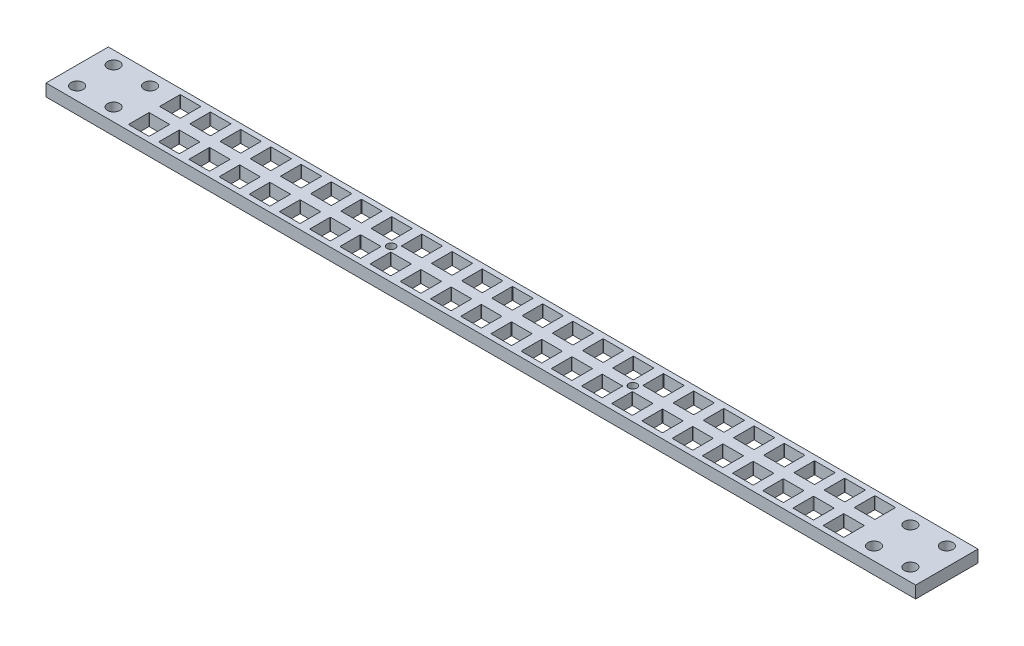
from build123d import *

# Parameters (mm, degrees)
SKETCH3_W           = 214.795858191
SKETCH3_H           = 15.4
SKETCH3_R           = 1.5
BOSS_EXTRUDE1_DEPTH = 3
SKETCH4_R           = 1
CUT_EXTRUDE1_DEPTH  = 10


with BuildPart() as part:
    # Sketch3 → Boss-Extrude1 (new body)
    with BuildSketch(Plane(origin=(0, 0, 0), x_dir=(1, 0, 0), z_dir=(0, 1, 0))):
        with Locations((30.920355434, 36.46812241)):
            Rectangle(SKETCH3_W, SKETCH3_H)
        with Locations(Location((-71.977573661, 40.96812241, 0), (0, 0, 270))):
            Circle(SKETCH3_R, mode=Mode.SUBTRACT)
        with Locations(Location((-62.977573661, 40.96812241, 0), (0, 0, 270))):
            Circle(SKETCH3_R, mode=Mode.SUBTRACT)
        with Locations(Location((-71.977573661, 31.96812241, 0), (0, 0, 270))):
            Circle(SKETCH3_R, mode=Mode.SUBTRACT)
        with Locations(Location((-62.977573661, 31.96812241, 0), (0, 0, 270))):
            Circle(SKETCH3_R, mode=Mode.SUBTRACT)
        with Locations(Location((124.81828453, 31.96812241, 0), (0, 0, 270))):
            Circle(SKETCH3_R, mode=Mode.SUBTRACT)
        with Locations(Location((133.81828453, 31.96812241, 0), (0, 0, 270))):
            Circle(SKETCH3_R, mode=Mode.SUBTRACT)
        with Locations(Location((124.81828453, 40.96812241, 0), (0, 0, 270))):
            Circle(SKETCH3_R, mode=Mode.SUBTRACT)
        with Locations(Location((133.81828453, 40.96812241, 0), (0, 0, 270))):
            Circle(SKETCH3_R, mode=Mode.SUBTRACT)
        with BuildLine():
            Line((-49.859644565, 35.16812241), (-44.959644565, 35.16812241))
            ThreePointArc((-44.959644565, 35.16812241), (-44.888933887, 35.138833089), (-44.859644565, 35.06812241))
            Line((-44.859644565, 35.06812241), (-44.859644565, 30.16812241))
            ThreePointArc((-44.859644565, 30.16812241), (-44.888933887, 30.097411732), (-44.959644565, 30.06812241))
            Line((-44.959644565, 30.06812241), (-49.859644565, 30.06812241))
            ThreePointArc((-49.859644565, 30.06812241), (-49.930355243, 30.097411732), (-49.959644565, 30.16812241))
            Line((-49.959644565, 30.16812241), (-49.959644565, 35.06812241))
            ThreePointArc((-49.959644565, 35.06812241), (-49.930355243, 35.138833089), (-49.859644565, 35.16812241))
        make_face(mode=Mode.SUBTRACT)
        with BuildLine():
            Line((-57.319644565, 35.16812241), (-52.419644565, 35.16812241))
            ThreePointArc((-52.419644565, 35.16812241), (-52.348933887, 35.138833089), (-52.319644565, 35.06812241))
            Line((-52.319644565, 35.06812241), (-52.319644565, 30.16812241))
            ThreePointArc((-52.319644565, 30.16812241), (-52.348933887, 30.097411732), (-52.419644565, 30.06812241))
            Line((-52.419644565, 30.06812241), (-57.319644565, 30.06812241))
            ThreePointArc((-57.319644565, 30.06812241), (-57.390355243, 30.097411732), (-57.419644565, 30.16812241))
            Line((-57.419644565, 30.16812241), (-57.419644565, 35.06812241))
            ThreePointArc((-57.419644565, 35.06812241), (-57.390355243, 35.138833089), (-57.319644565, 35.16812241))
        make_face(mode=Mode.SUBTRACT)
        with BuildLine():
            Line((-42.399644565, 35.16812241), (-37.499644565, 35.16812241))
            ThreePointArc((-37.499644565, 35.16812241), (-37.428933887, 35.138833089), (-37.399644565, 35.06812241))
            Line((-37.399644565, 35.06812241), (-37.399644565, 30.16812241))
            ThreePointArc((-37.399644565, 30.16812241), (-37.428933887, 30.097411732), (-37.499644565, 30.06812241))
            Line((-37.499644565, 30.06812241), (-42.399644565, 30.06812241))
            ThreePointArc((-42.399644565, 30.06812241), (-42.470355243, 30.097411732), (-42.499644565, 30.16812241))
            Line((-42.499644565, 30.16812241), (-42.499644565, 35.06812241))
            ThreePointArc((-42.499644565, 35.06812241), (-42.470355243, 35.138833089), (-42.399644565, 35.16812241))
        make_face(mode=Mode.SUBTRACT)
        with BuildLine():
            Line((-34.939644565, 35.16812241), (-30.039644565, 35.16812241))
            ThreePointArc((-30.039644565, 35.16812241), (-29.968933887, 35.138833089), (-29.939644565, 35.06812241))
            Line((-29.939644565, 35.06812241), (-29.939644565, 30.16812241))
            ThreePointArc((-29.939644565, 30.16812241), (-29.968933887, 30.097411732), (-30.039644565, 30.06812241))
            Line((-30.039644565, 30.06812241), (-34.939644565, 30.06812241))
            ThreePointArc((-34.939644565, 30.06812241), (-35.010355243, 30.097411732), (-35.039644565, 30.16812241))
            Line((-35.039644565, 30.16812241), (-35.039644565, 35.06812241))
            ThreePointArc((-35.039644565, 35.06812241), (-35.010355243, 35.138833089), (-34.939644565, 35.16812241))
        make_face(mode=Mode.SUBTRACT)
        with BuildLine():
            Line((-27.479644565, 35.16812241), (-22.579644565, 35.16812241))
            ThreePointArc((-22.579644565, 35.16812241), (-22.508933887, 35.138833089), (-22.479644565, 35.06812241))
            Line((-22.479644565, 35.06812241), (-22.479644565, 30.16812241))
            ThreePointArc((-22.479644565, 30.16812241), (-22.508933887, 30.097411732), (-22.579644565, 30.06812241))
            Line((-22.579644565, 30.06812241), (-27.479644565, 30.06812241))
            ThreePointArc((-27.479644565, 30.06812241), (-27.550355243, 30.097411732), (-27.579644565, 30.16812241))
            Line((-27.579644565, 30.16812241), (-27.579644565, 35.06812241))
            ThreePointArc((-27.579644565, 35.06812241), (-27.550355243, 35.138833089), (-27.479644565, 35.16812241))
        make_face(mode=Mode.SUBTRACT)
        with BuildLine():
            Line((-20.019644565, 35.16812241), (-15.119644565, 35.16812241))
            ThreePointArc((-15.119644565, 35.16812241), (-15.048933887, 35.138833089), (-15.019644565, 35.06812241))
            Line((-15.019644565, 35.06812241), (-15.019644565, 30.16812241))
            ThreePointArc((-15.019644565, 30.16812241), (-15.048933887, 30.097411732), (-15.119644565, 30.06812241))
            Line((-15.119644565, 30.06812241), (-20.019644565, 30.06812241))
            ThreePointArc((-20.019644565, 30.06812241), (-20.090355243, 30.097411732), (-20.119644565, 30.16812241))
            Line((-20.119644565, 30.16812241), (-20.119644565, 35.06812241))
            ThreePointArc((-20.119644565, 35.06812241), (-20.090355243, 35.138833089), (-20.019644565, 35.16812241))
        make_face(mode=Mode.SUBTRACT)
        with BuildLine():
            Line((-12.559644565, 35.16812241), (-7.659644565, 35.16812241))
            ThreePointArc((-7.659644565, 35.16812241), (-7.588933887, 35.138833089), (-7.559644565, 35.06812241))
            Line((-7.559644565, 35.06812241), (-7.559644565, 30.16812241))
            ThreePointArc((-7.559644565, 30.16812241), (-7.588933887, 30.097411732), (-7.659644565, 30.06812241))
            Line((-7.659644565, 30.06812241), (-12.559644565, 30.06812241))
            ThreePointArc((-12.559644565, 30.06812241), (-12.630355243, 30.097411732), (-12.659644565, 30.16812241))
            Line((-12.659644565, 30.16812241), (-12.659644565, 35.06812241))
            ThreePointArc((-12.659644565, 35.06812241), (-12.630355243, 35.138833089), (-12.559644565, 35.16812241))
        make_face(mode=Mode.SUBTRACT)
        with BuildLine():
            Line((-5.099644565, 35.16812241), (-0.199644565, 35.16812241))
            ThreePointArc((-0.199644565, 35.16812241), (-0.128933887, 35.138833089), (-0.099644565, 35.06812241))
            Line((-0.099644565, 35.06812241), (-0.099644565, 30.16812241))
            ThreePointArc((-0.099644565, 30.16812241), (-0.128933887, 30.097411732), (-0.199644565, 30.06812241))
            Line((-0.199644565, 30.06812241), (-5.099644565, 30.06812241))
            ThreePointArc((-5.099644565, 30.06812241), (-5.170355243, 30.097411732), (-5.199644565, 30.16812241))
            Line((-5.199644565, 30.16812241), (-5.199644565, 35.06812241))
            ThreePointArc((-5.199644565, 35.06812241), (-5.170355243, 35.138833089), (-5.099644565, 35.16812241))
        make_face(mode=Mode.SUBTRACT)
        with BuildLine():
            Line((2.360355435, 35.16812241), (7.260355435, 35.16812241))
            ThreePointArc((7.260355435, 35.16812241), (7.331066113, 35.138833089), (7.360355435, 35.06812241))
            Line((7.360355435, 35.06812241), (7.360355435, 30.16812241))
            ThreePointArc((7.360355435, 30.16812241), (7.331066113, 30.097411732), (7.260355435, 30.06812241))
            Line((7.260355435, 30.06812241), (2.360355435, 30.06812241))
            ThreePointArc((2.360355435, 30.06812241), (2.289644757, 30.097411732), (2.260355435, 30.16812241))
            Line((2.260355435, 30.16812241), (2.260355435, 35.06812241))
            ThreePointArc((2.260355435, 35.06812241), (2.289644757, 35.138833089), (2.360355435, 35.16812241))
        make_face(mode=Mode.SUBTRACT)
        with BuildLine():
            Line((9.820355435, 35.16812241), (14.720355435, 35.16812241))
            ThreePointArc((14.720355435, 35.16812241), (14.791066113, 35.138833089), (14.820355435, 35.06812241))
            Line((14.820355435, 35.06812241), (14.820355435, 30.16812241))
            ThreePointArc((14.820355435, 30.16812241), (14.791066113, 30.097411732), (14.720355435, 30.06812241))
            Line((14.720355435, 30.06812241), (9.820355435, 30.06812241))
            ThreePointArc((9.820355435, 30.06812241), (9.749644757, 30.097411732), (9.720355435, 30.16812241))
            Line((9.720355435, 30.16812241), (9.720355435, 35.06812241))
            ThreePointArc((9.720355435, 35.06812241), (9.749644757, 35.138833089), (9.820355435, 35.16812241))
        make_face(mode=Mode.SUBTRACT)
        with BuildLine():
            Line((17.280355435, 35.16812241), (22.180355435, 35.16812241))
            ThreePointArc((22.180355435, 35.16812241), (22.251066113, 35.138833089), (22.280355435, 35.06812241))
            Line((22.280355435, 35.06812241), (22.280355435, 30.16812241))
            ThreePointArc((22.280355435, 30.16812241), (22.251066113, 30.097411732), (22.180355435, 30.06812241))
            Line((22.180355435, 30.06812241), (17.280355435, 30.06812241))
            ThreePointArc((17.280355435, 30.06812241), (17.209644757, 30.097411732), (17.180355435, 30.16812241))
            Line((17.180355435, 30.16812241), (17.180355435, 35.06812241))
            ThreePointArc((17.180355435, 35.06812241), (17.209644757, 35.138833089), (17.280355435, 35.16812241))
        make_face(mode=Mode.SUBTRACT)
        with BuildLine():
            Line((24.740355435, 35.16812241), (29.640355435, 35.16812241))
            ThreePointArc((29.640355435, 35.16812241), (29.711066113, 35.138833089), (29.740355435, 35.06812241))
            Line((29.740355435, 35.06812241), (29.740355435, 30.16812241))
            ThreePointArc((29.740355435, 30.16812241), (29.711066113, 30.097411732), (29.640355435, 30.06812241))
            Line((29.640355435, 30.06812241), (24.740355435, 30.06812241))
            ThreePointArc((24.740355435, 30.06812241), (24.669644757, 30.097411732), (24.640355435, 30.16812241))
            Line((24.640355435, 30.16812241), (24.640355435, 35.06812241))
            ThreePointArc((24.640355435, 35.06812241), (24.669644757, 35.138833089), (24.740355435, 35.16812241))
        make_face(mode=Mode.SUBTRACT)
        with BuildLine():
            Line((32.200355435, 35.16812241), (37.100355435, 35.16812241))
            ThreePointArc((37.100355435, 35.16812241), (37.171066113, 35.138833089), (37.200355435, 35.06812241))
            Line((37.200355435, 35.06812241), (37.200355435, 30.16812241))
            ThreePointArc((37.200355435, 30.16812241), (37.171066113, 30.097411732), (37.100355435, 30.06812241))
            Line((37.100355435, 30.06812241), (32.200355435, 30.06812241))
            ThreePointArc((32.200355435, 30.06812241), (32.129644757, 30.097411732), (32.100355435, 30.16812241))
            Line((32.100355435, 30.16812241), (32.100355435, 35.06812241))
            ThreePointArc((32.100355435, 35.06812241), (32.129644757, 35.138833089), (32.200355435, 35.16812241))
        make_face(mode=Mode.SUBTRACT)
        with BuildLine():
            Line((39.660355435, 35.16812241), (44.560355435, 35.16812241))
            ThreePointArc((44.560355435, 35.16812241), (44.631066113, 35.138833089), (44.660355435, 35.06812241))
            Line((44.660355435, 35.06812241), (44.660355435, 30.16812241))
            ThreePointArc((44.660355435, 30.16812241), (44.631066113, 30.097411732), (44.560355435, 30.06812241))
            Line((44.560355435, 30.06812241), (39.660355435, 30.06812241))
            ThreePointArc((39.660355435, 30.06812241), (39.589644757, 30.097411732), (39.560355435, 30.16812241))
            Line((39.560355435, 30.16812241), (39.560355435, 35.06812241))
            ThreePointArc((39.560355435, 35.06812241), (39.589644757, 35.138833089), (39.660355435, 35.16812241))
        make_face(mode=Mode.SUBTRACT)
        with BuildLine():
            Line((47.120355435, 35.16812241), (52.020355435, 35.16812241))
            ThreePointArc((52.020355435, 35.16812241), (52.091066113, 35.138833089), (52.120355435, 35.06812241))
            Line((52.120355435, 35.06812241), (52.120355435, 30.16812241))
            ThreePointArc((52.120355435, 30.16812241), (52.091066113, 30.097411732), (52.020355435, 30.06812241))
            Line((52.020355435, 30.06812241), (47.120355435, 30.06812241))
            ThreePointArc((47.120355435, 30.06812241), (47.049644757, 30.097411732), (47.020355435, 30.16812241))
            Line((47.020355435, 30.16812241), (47.020355435, 35.06812241))
            ThreePointArc((47.020355435, 35.06812241), (47.049644757, 35.138833089), (47.120355435, 35.16812241))
        make_face(mode=Mode.SUBTRACT)
        with BuildLine():
            Line((54.580355435, 35.16812241), (59.480355435, 35.16812241))
            ThreePointArc((59.480355435, 35.16812241), (59.551066113, 35.138833089), (59.580355435, 35.06812241))
            Line((59.580355435, 35.06812241), (59.580355435, 30.16812241))
            ThreePointArc((59.580355435, 30.16812241), (59.551066113, 30.097411732), (59.480355435, 30.06812241))
            Line((59.480355435, 30.06812241), (54.580355435, 30.06812241))
            ThreePointArc((54.580355435, 30.06812241), (54.509644757, 30.097411732), (54.480355435, 30.16812241))
            Line((54.480355435, 30.16812241), (54.480355435, 35.06812241))
            ThreePointArc((54.480355435, 35.06812241), (54.509644757, 35.138833089), (54.580355435, 35.16812241))
        make_face(mode=Mode.SUBTRACT)
        with BuildLine():
            Line((62.040355435, 35.16812241), (66.940355435, 35.16812241))
            ThreePointArc((66.940355435, 35.16812241), (67.011066113, 35.138833089), (67.040355435, 35.06812241))
            Line((67.040355435, 35.06812241), (67.040355435, 30.16812241))
            ThreePointArc((67.040355435, 30.16812241), (67.011066113, 30.097411732), (66.940355435, 30.06812241))
            Line((66.940355435, 30.06812241), (62.040355435, 30.06812241))
            ThreePointArc((62.040355435, 30.06812241), (61.969644757, 30.097411732), (61.940355435, 30.16812241))
            Line((61.940355435, 30.16812241), (61.940355435, 35.06812241))
            ThreePointArc((61.940355435, 35.06812241), (61.969644757, 35.138833089), (62.040355435, 35.16812241))
        make_face(mode=Mode.SUBTRACT)
        with BuildLine():
            Line((69.500355435, 35.16812241), (74.400355435, 35.16812241))
            ThreePointArc((74.400355435, 35.16812241), (74.471066113, 35.138833089), (74.500355435, 35.06812241))
            Line((74.500355435, 35.06812241), (74.500355435, 30.16812241))
            ThreePointArc((74.500355435, 30.16812241), (74.471066113, 30.097411732), (74.400355435, 30.06812241))
            Line((74.400355435, 30.06812241), (69.500355435, 30.06812241))
            ThreePointArc((69.500355435, 30.06812241), (69.429644757, 30.097411732), (69.400355435, 30.16812241))
            Line((69.400355435, 30.16812241), (69.400355435, 35.06812241))
            ThreePointArc((69.400355435, 35.06812241), (69.429644757, 35.138833089), (69.500355435, 35.16812241))
        make_face(mode=Mode.SUBTRACT)
        with BuildLine():
            Line((76.960355435, 35.16812241), (81.860355435, 35.16812241))
            ThreePointArc((81.860355435, 35.16812241), (81.931066113, 35.138833089), (81.960355435, 35.06812241))
            Line((81.960355435, 35.06812241), (81.960355435, 30.16812241))
            ThreePointArc((81.960355435, 30.16812241), (81.931066113, 30.097411732), (81.860355435, 30.06812241))
            Line((81.860355435, 30.06812241), (76.960355435, 30.06812241))
            ThreePointArc((76.960355435, 30.06812241), (76.889644757, 30.097411732), (76.860355435, 30.16812241))
            Line((76.860355435, 30.16812241), (76.860355435, 35.06812241))
            ThreePointArc((76.860355435, 35.06812241), (76.889644757, 35.138833089), (76.960355435, 35.16812241))
        make_face(mode=Mode.SUBTRACT)
        with BuildLine():
            Line((84.420355435, 35.16812241), (89.320355435, 35.16812241))
            ThreePointArc((89.320355435, 35.16812241), (89.391066113, 35.138833089), (89.420355435, 35.06812241))
            Line((89.420355435, 35.06812241), (89.420355435, 30.16812241))
            ThreePointArc((89.420355435, 30.16812241), (89.391066113, 30.097411732), (89.320355435, 30.06812241))
            Line((89.320355435, 30.06812241), (84.420355435, 30.06812241))
            ThreePointArc((84.420355435, 30.06812241), (84.349644757, 30.097411732), (84.320355435, 30.16812241))
            Line((84.320355435, 30.16812241), (84.320355435, 35.06812241))
            ThreePointArc((84.320355435, 35.06812241), (84.349644757, 35.138833089), (84.420355435, 35.16812241))
        make_face(mode=Mode.SUBTRACT)
        with BuildLine():
            Line((91.880355435, 35.16812241), (96.780355435, 35.16812241))
            ThreePointArc((96.780355435, 35.16812241), (96.851066113, 35.138833089), (96.880355435, 35.06812241))
            Line((96.880355435, 35.06812241), (96.880355435, 30.16812241))
            ThreePointArc((96.880355435, 30.16812241), (96.851066113, 30.097411732), (96.780355435, 30.06812241))
            Line((96.780355435, 30.06812241), (91.880355435, 30.06812241))
            ThreePointArc((91.880355435, 30.06812241), (91.809644757, 30.097411732), (91.780355435, 30.16812241))
            Line((91.780355435, 30.16812241), (91.780355435, 35.06812241))
            ThreePointArc((91.780355435, 35.06812241), (91.809644757, 35.138833089), (91.880355435, 35.16812241))
        make_face(mode=Mode.SUBTRACT)
        with BuildLine():
            Line((99.340355435, 35.16812241), (104.240355435, 35.16812241))
            ThreePointArc((104.240355435, 35.16812241), (104.311066113, 35.138833089), (104.340355435, 35.06812241))
            Line((104.340355435, 35.06812241), (104.340355435, 30.16812241))
            ThreePointArc((104.340355435, 30.16812241), (104.311066113, 30.097411732), (104.240355435, 30.06812241))
            Line((104.240355435, 30.06812241), (99.340355435, 30.06812241))
            ThreePointArc((99.340355435, 30.06812241), (99.269644757, 30.097411732), (99.240355435, 30.16812241))
            Line((99.240355435, 30.16812241), (99.240355435, 35.06812241))
            ThreePointArc((99.240355435, 35.06812241), (99.269644757, 35.138833089), (99.340355435, 35.16812241))
        make_face(mode=Mode.SUBTRACT)
        with BuildLine():
            Line((106.800355435, 35.16812241), (111.700355435, 35.16812241))
            ThreePointArc((111.700355435, 35.16812241), (111.771066113, 35.138833089), (111.800355435, 35.06812241))
            Line((111.800355435, 35.06812241), (111.800355435, 30.16812241))
            ThreePointArc((111.800355435, 30.16812241), (111.771066113, 30.097411732), (111.700355435, 30.06812241))
            Line((111.700355435, 30.06812241), (106.800355435, 30.06812241))
            ThreePointArc((106.800355435, 30.06812241), (106.729644757, 30.097411732), (106.700355435, 30.16812241))
            Line((106.700355435, 30.16812241), (106.700355435, 35.06812241))
            ThreePointArc((106.700355435, 35.06812241), (106.729644757, 35.138833089), (106.800355435, 35.16812241))
        make_face(mode=Mode.SUBTRACT)
        with BuildLine():
            Line((114.260355435, 35.16812241), (119.160355435, 35.16812241))
            ThreePointArc((119.160355435, 35.16812241), (119.231066113, 35.138833089), (119.260355435, 35.06812241))
            Line((119.260355435, 35.06812241), (119.260355435, 30.16812241))
            ThreePointArc((119.260355435, 30.16812241), (119.231066113, 30.097411732), (119.160355435, 30.06812241))
            Line((119.160355435, 30.06812241), (114.260355435, 30.06812241))
            ThreePointArc((114.260355435, 30.06812241), (114.189644757, 30.097411732), (114.160355435, 30.16812241))
            Line((114.160355435, 30.16812241), (114.160355435, 35.06812241))
            ThreePointArc((114.160355435, 35.06812241), (114.189644757, 35.138833089), (114.260355435, 35.16812241))
        make_face(mode=Mode.SUBTRACT)
        with BuildLine():
            Line((119.260355435, 37.86812241), (119.260355435, 42.76812241))
            ThreePointArc((119.260355435, 42.76812241), (119.231066113, 42.838833089), (119.160355435, 42.86812241))
            Line((119.160355435, 42.86812241), (114.260355435, 42.86812241))
            ThreePointArc((114.260355435, 42.86812241), (114.189644757, 42.838833089), (114.160355435, 42.76812241))
            Line((114.160355435, 42.76812241), (114.160355435, 37.86812241))
            ThreePointArc((114.160355435, 37.86812241), (114.189644757, 37.797411732), (114.260355435, 37.76812241))
            Line((114.260355435, 37.76812241), (119.160355435, 37.76812241))
            ThreePointArc((119.160355435, 37.76812241), (119.231066113, 37.797411732), (119.260355435, 37.86812241))
        make_face(mode=Mode.SUBTRACT)
        with BuildLine():
            Line((111.800355435, 37.86812241), (111.800355435, 42.76812241))
            ThreePointArc((111.800355435, 42.76812241), (111.771066113, 42.838833089), (111.700355435, 42.86812241))
            Line((111.700355435, 42.86812241), (106.800355435, 42.86812241))
            ThreePointArc((106.800355435, 42.86812241), (106.729644757, 42.838833089), (106.700355435, 42.76812241))
            Line((106.700355435, 42.76812241), (106.700355435, 37.86812241))
            ThreePointArc((106.700355435, 37.86812241), (106.729644757, 37.797411732), (106.800355435, 37.76812241))
            Line((106.800355435, 37.76812241), (111.700355435, 37.76812241))
            ThreePointArc((111.700355435, 37.76812241), (111.771066113, 37.797411732), (111.800355435, 37.86812241))
        make_face(mode=Mode.SUBTRACT)
        with BuildLine():
            Line((104.340355435, 37.86812241), (104.340355435, 42.76812241))
            ThreePointArc((104.340355435, 42.76812241), (104.311066113, 42.838833089), (104.240355435, 42.86812241))
            Line((104.240355435, 42.86812241), (99.340355435, 42.86812241))
            ThreePointArc((99.340355435, 42.86812241), (99.269644757, 42.838833089), (99.240355435, 42.76812241))
            Line((99.240355435, 42.76812241), (99.240355435, 37.86812241))
            ThreePointArc((99.240355435, 37.86812241), (99.269644757, 37.797411732), (99.340355435, 37.76812241))
            Line((99.340355435, 37.76812241), (104.240355435, 37.76812241))
            ThreePointArc((104.240355435, 37.76812241), (104.311066113, 37.797411732), (104.340355435, 37.86812241))
        make_face(mode=Mode.SUBTRACT)
        with BuildLine():
            Line((96.880355435, 37.86812241), (96.880355435, 42.76812241))
            ThreePointArc((96.880355435, 42.76812241), (96.851066113, 42.838833089), (96.780355435, 42.86812241))
            Line((96.780355435, 42.86812241), (91.880355435, 42.86812241))
            ThreePointArc((91.880355435, 42.86812241), (91.809644757, 42.838833089), (91.780355435, 42.76812241))
            Line((91.780355435, 42.76812241), (91.780355435, 37.86812241))
            ThreePointArc((91.780355435, 37.86812241), (91.809644757, 37.797411732), (91.880355435, 37.76812241))
            Line((91.880355435, 37.76812241), (96.780355435, 37.76812241))
            ThreePointArc((96.780355435, 37.76812241), (96.851066113, 37.797411732), (96.880355435, 37.86812241))
        make_face(mode=Mode.SUBTRACT)
        with BuildLine():
            Line((89.420355435, 37.86812241), (89.420355435, 42.76812241))
            ThreePointArc((89.420355435, 42.76812241), (89.391066113, 42.838833089), (89.320355435, 42.86812241))
            Line((89.320355435, 42.86812241), (84.420355435, 42.86812241))
            ThreePointArc((84.420355435, 42.86812241), (84.349644757, 42.838833089), (84.320355435, 42.76812241))
            Line((84.320355435, 42.76812241), (84.320355435, 37.86812241))
            ThreePointArc((84.320355435, 37.86812241), (84.349644757, 37.797411732), (84.420355435, 37.76812241))
            Line((84.420355435, 37.76812241), (89.320355435, 37.76812241))
            ThreePointArc((89.320355435, 37.76812241), (89.391066113, 37.797411732), (89.420355435, 37.86812241))
        make_face(mode=Mode.SUBTRACT)
        with BuildLine():
            Line((81.960355435, 37.86812241), (81.960355435, 42.76812241))
            ThreePointArc((81.960355435, 42.76812241), (81.931066113, 42.838833089), (81.860355435, 42.86812241))
            Line((81.860355435, 42.86812241), (76.960355435, 42.86812241))
            ThreePointArc((76.960355435, 42.86812241), (76.889644757, 42.838833089), (76.860355435, 42.76812241))
            Line((76.860355435, 42.76812241), (76.860355435, 37.86812241))
            ThreePointArc((76.860355435, 37.86812241), (76.889644757, 37.797411732), (76.960355435, 37.76812241))
            Line((76.960355435, 37.76812241), (81.860355435, 37.76812241))
            ThreePointArc((81.860355435, 37.76812241), (81.931066113, 37.797411732), (81.960355435, 37.86812241))
        make_face(mode=Mode.SUBTRACT)
        with BuildLine():
            Line((74.500355435, 37.86812241), (74.500355435, 42.76812241))
            ThreePointArc((74.500355435, 42.76812241), (74.471066113, 42.838833089), (74.400355435, 42.86812241))
            Line((74.400355435, 42.86812241), (69.500355435, 42.86812241))
            ThreePointArc((69.500355435, 42.86812241), (69.429644757, 42.838833089), (69.400355435, 42.76812241))
            Line((69.400355435, 42.76812241), (69.400355435, 37.86812241))
            ThreePointArc((69.400355435, 37.86812241), (69.429644757, 37.797411732), (69.500355435, 37.76812241))
            Line((69.500355435, 37.76812241), (74.400355435, 37.76812241))
            ThreePointArc((74.400355435, 37.76812241), (74.471066113, 37.797411732), (74.500355435, 37.86812241))
        make_face(mode=Mode.SUBTRACT)
        with BuildLine():
            Line((67.040355435, 37.86812241), (67.040355435, 42.76812241))
            ThreePointArc((67.040355435, 42.76812241), (67.011066113, 42.838833089), (66.940355435, 42.86812241))
            Line((66.940355435, 42.86812241), (62.040355435, 42.86812241))
            ThreePointArc((62.040355435, 42.86812241), (61.969644757, 42.838833089), (61.940355435, 42.76812241))
            Line((61.940355435, 42.76812241), (61.940355435, 37.86812241))
            ThreePointArc((61.940355435, 37.86812241), (61.969644757, 37.797411732), (62.040355435, 37.76812241))
            Line((62.040355435, 37.76812241), (66.940355435, 37.76812241))
            ThreePointArc((66.940355435, 37.76812241), (67.011066113, 37.797411732), (67.040355435, 37.86812241))
        make_face(mode=Mode.SUBTRACT)
        with BuildLine():
            Line((59.580355435, 37.86812241), (59.580355435, 42.76812241))
            ThreePointArc((59.580355435, 42.76812241), (59.551066113, 42.838833089), (59.480355435, 42.86812241))
            Line((59.480355435, 42.86812241), (54.580355435, 42.86812241))
            ThreePointArc((54.580355435, 42.86812241), (54.509644757, 42.838833089), (54.480355435, 42.76812241))
            Line((54.480355435, 42.76812241), (54.480355435, 37.86812241))
            ThreePointArc((54.480355435, 37.86812241), (54.509644757, 37.797411732), (54.580355435, 37.76812241))
            Line((54.580355435, 37.76812241), (59.480355435, 37.76812241))
            ThreePointArc((59.480355435, 37.76812241), (59.551066113, 37.797411732), (59.580355435, 37.86812241))
        make_face(mode=Mode.SUBTRACT)
        with BuildLine():
            Line((52.120355435, 37.86812241), (52.120355435, 42.76812241))
            ThreePointArc((52.120355435, 42.76812241), (52.091066113, 42.838833089), (52.020355435, 42.86812241))
            Line((52.020355435, 42.86812241), (47.120355435, 42.86812241))
            ThreePointArc((47.120355435, 42.86812241), (47.049644757, 42.838833089), (47.020355435, 42.76812241))
            Line((47.020355435, 42.76812241), (47.020355435, 37.86812241))
            ThreePointArc((47.020355435, 37.86812241), (47.049644757, 37.797411732), (47.120355435, 37.76812241))
            Line((47.120355435, 37.76812241), (52.020355435, 37.76812241))
            ThreePointArc((52.020355435, 37.76812241), (52.091066113, 37.797411732), (52.120355435, 37.86812241))
        make_face(mode=Mode.SUBTRACT)
        with BuildLine():
            Line((44.660355435, 37.86812241), (44.660355435, 42.76812241))
            ThreePointArc((44.660355435, 42.76812241), (44.631066113, 42.838833089), (44.560355435, 42.86812241))
            Line((44.560355435, 42.86812241), (39.660355435, 42.86812241))
            ThreePointArc((39.660355435, 42.86812241), (39.589644757, 42.838833089), (39.560355435, 42.76812241))
            Line((39.560355435, 42.76812241), (39.560355435, 37.86812241))
            ThreePointArc((39.560355435, 37.86812241), (39.589644757, 37.797411732), (39.660355435, 37.76812241))
            Line((39.660355435, 37.76812241), (44.560355435, 37.76812241))
            ThreePointArc((44.560355435, 37.76812241), (44.631066113, 37.797411732), (44.660355435, 37.86812241))
        make_face(mode=Mode.SUBTRACT)
        with BuildLine():
            Line((37.200355435, 37.86812241), (37.200355435, 42.76812241))
            ThreePointArc((37.200355435, 42.76812241), (37.171066113, 42.838833089), (37.100355435, 42.86812241))
            Line((37.100355435, 42.86812241), (32.200355435, 42.86812241))
            ThreePointArc((32.200355435, 42.86812241), (32.129644757, 42.838833089), (32.100355435, 42.76812241))
            Line((32.100355435, 42.76812241), (32.100355435, 37.86812241))
            ThreePointArc((32.100355435, 37.86812241), (32.129644757, 37.797411732), (32.200355435, 37.76812241))
            Line((32.200355435, 37.76812241), (37.100355435, 37.76812241))
            ThreePointArc((37.100355435, 37.76812241), (37.171066113, 37.797411732), (37.200355435, 37.86812241))
        make_face(mode=Mode.SUBTRACT)
        with BuildLine():
            Line((29.740355435, 37.86812241), (29.740355435, 42.76812241))
            ThreePointArc((29.740355435, 42.76812241), (29.711066113, 42.838833089), (29.640355435, 42.86812241))
            Line((29.640355435, 42.86812241), (24.740355435, 42.86812241))
            ThreePointArc((24.740355435, 42.86812241), (24.669644757, 42.838833089), (24.640355435, 42.76812241))
            Line((24.640355435, 42.76812241), (24.640355435, 37.86812241))
            ThreePointArc((24.640355435, 37.86812241), (24.669644757, 37.797411732), (24.740355435, 37.76812241))
            Line((24.740355435, 37.76812241), (29.640355435, 37.76812241))
            ThreePointArc((29.640355435, 37.76812241), (29.711066113, 37.797411732), (29.740355435, 37.86812241))
        make_face(mode=Mode.SUBTRACT)
        with BuildLine():
            Line((22.280355435, 37.86812241), (22.280355435, 42.76812241))
            ThreePointArc((22.280355435, 42.76812241), (22.251066113, 42.838833089), (22.180355435, 42.86812241))
            Line((22.180355435, 42.86812241), (17.280355435, 42.86812241))
            ThreePointArc((17.280355435, 42.86812241), (17.209644757, 42.838833089), (17.180355435, 42.76812241))
            Line((17.180355435, 42.76812241), (17.180355435, 37.86812241))
            ThreePointArc((17.180355435, 37.86812241), (17.209644757, 37.797411732), (17.280355435, 37.76812241))
            Line((17.280355435, 37.76812241), (22.180355435, 37.76812241))
            ThreePointArc((22.180355435, 37.76812241), (22.251066113, 37.797411732), (22.280355435, 37.86812241))
        make_face(mode=Mode.SUBTRACT)
        with BuildLine():
            Line((14.820355435, 37.86812241), (14.820355435, 42.76812241))
            ThreePointArc((14.820355435, 42.76812241), (14.791066113, 42.838833089), (14.720355435, 42.86812241))
            Line((14.720355435, 42.86812241), (9.820355435, 42.86812241))
            ThreePointArc((9.820355435, 42.86812241), (9.749644757, 42.838833089), (9.720355435, 42.76812241))
            Line((9.720355435, 42.76812241), (9.720355435, 37.86812241))
            ThreePointArc((9.720355435, 37.86812241), (9.749644757, 37.797411732), (9.820355435, 37.76812241))
            Line((9.820355435, 37.76812241), (14.720355435, 37.76812241))
            ThreePointArc((14.720355435, 37.76812241), (14.791066113, 37.797411732), (14.820355435, 37.86812241))
        make_face(mode=Mode.SUBTRACT)
        with BuildLine():
            Line((7.360355435, 37.86812241), (7.360355435, 42.76812241))
            ThreePointArc((7.360355435, 42.76812241), (7.331066113, 42.838833089), (7.260355435, 42.86812241))
            Line((7.260355435, 42.86812241), (2.360355435, 42.86812241))
            ThreePointArc((2.360355435, 42.86812241), (2.289644757, 42.838833089), (2.260355435, 42.76812241))
            Line((2.260355435, 42.76812241), (2.260355435, 37.86812241))
            ThreePointArc((2.260355435, 37.86812241), (2.289644757, 37.797411732), (2.360355435, 37.76812241))
            Line((2.360355435, 37.76812241), (7.260355435, 37.76812241))
            ThreePointArc((7.260355435, 37.76812241), (7.331066113, 37.797411732), (7.360355435, 37.86812241))
        make_face(mode=Mode.SUBTRACT)
        with BuildLine():
            Line((-0.099644565, 37.86812241), (-0.099644565, 42.76812241))
            ThreePointArc((-0.099644565, 42.76812241), (-0.128933887, 42.838833089), (-0.199644565, 42.86812241))
            Line((-0.199644565, 42.86812241), (-5.099644565, 42.86812241))
            ThreePointArc((-5.099644565, 42.86812241), (-5.170355243, 42.838833089), (-5.199644565, 42.76812241))
            Line((-5.199644565, 42.76812241), (-5.199644565, 37.86812241))
            ThreePointArc((-5.199644565, 37.86812241), (-5.170355243, 37.797411732), (-5.099644565, 37.76812241))
            Line((-5.099644565, 37.76812241), (-0.199644565, 37.76812241))
            ThreePointArc((-0.199644565, 37.76812241), (-0.128933887, 37.797411732), (-0.099644565, 37.86812241))
        make_face(mode=Mode.SUBTRACT)
        with BuildLine():
            Line((-7.559644565, 37.86812241), (-7.559644565, 42.76812241))
            ThreePointArc((-7.559644565, 42.76812241), (-7.588933887, 42.838833089), (-7.659644565, 42.86812241))
            Line((-7.659644565, 42.86812241), (-12.559644565, 42.86812241))
            ThreePointArc((-12.559644565, 42.86812241), (-12.630355243, 42.838833089), (-12.659644565, 42.76812241))
            Line((-12.659644565, 42.76812241), (-12.659644565, 37.86812241))
            ThreePointArc((-12.659644565, 37.86812241), (-12.630355243, 37.797411732), (-12.559644565, 37.76812241))
            Line((-12.559644565, 37.76812241), (-7.659644565, 37.76812241))
            ThreePointArc((-7.659644565, 37.76812241), (-7.588933887, 37.797411732), (-7.559644565, 37.86812241))
        make_face(mode=Mode.SUBTRACT)
        with BuildLine():
            Line((-15.019644565, 37.86812241), (-15.019644565, 42.76812241))
            ThreePointArc((-15.019644565, 42.76812241), (-15.048933887, 42.838833089), (-15.119644565, 42.86812241))
            Line((-15.119644565, 42.86812241), (-20.019644565, 42.86812241))
            ThreePointArc((-20.019644565, 42.86812241), (-20.090355243, 42.838833089), (-20.119644565, 42.76812241))
            Line((-20.119644565, 42.76812241), (-20.119644565, 37.86812241))
            ThreePointArc((-20.119644565, 37.86812241), (-20.090355243, 37.797411732), (-20.019644565, 37.76812241))
            Line((-20.019644565, 37.76812241), (-15.119644565, 37.76812241))
            ThreePointArc((-15.119644565, 37.76812241), (-15.048933887, 37.797411732), (-15.019644565, 37.86812241))
        make_face(mode=Mode.SUBTRACT)
        with BuildLine():
            Line((-22.479644565, 37.86812241), (-22.479644565, 42.76812241))
            ThreePointArc((-22.479644565, 42.76812241), (-22.508933887, 42.838833089), (-22.579644565, 42.86812241))
            Line((-22.579644565, 42.86812241), (-27.479644565, 42.86812241))
            ThreePointArc((-27.479644565, 42.86812241), (-27.550355243, 42.838833089), (-27.579644565, 42.76812241))
            Line((-27.579644565, 42.76812241), (-27.579644565, 37.86812241))
            ThreePointArc((-27.579644565, 37.86812241), (-27.550355243, 37.797411732), (-27.479644565, 37.76812241))
            Line((-27.479644565, 37.76812241), (-22.579644565, 37.76812241))
            ThreePointArc((-22.579644565, 37.76812241), (-22.508933887, 37.797411732), (-22.479644565, 37.86812241))
        make_face(mode=Mode.SUBTRACT)
        with BuildLine():
            Line((-29.939644565, 37.86812241), (-29.939644565, 42.76812241))
            ThreePointArc((-29.939644565, 42.76812241), (-29.968933887, 42.838833089), (-30.039644565, 42.86812241))
            Line((-30.039644565, 42.86812241), (-34.939644565, 42.86812241))
            ThreePointArc((-34.939644565, 42.86812241), (-35.010355243, 42.838833089), (-35.039644565, 42.76812241))
            Line((-35.039644565, 42.76812241), (-35.039644565, 37.86812241))
            ThreePointArc((-35.039644565, 37.86812241), (-35.010355243, 37.797411732), (-34.939644565, 37.76812241))
            Line((-34.939644565, 37.76812241), (-30.039644565, 37.76812241))
            ThreePointArc((-30.039644565, 37.76812241), (-29.968933887, 37.797411732), (-29.939644565, 37.86812241))
        make_face(mode=Mode.SUBTRACT)
        with BuildLine():
            Line((-37.399644565, 37.86812241), (-37.399644565, 42.76812241))
            ThreePointArc((-37.399644565, 42.76812241), (-37.428933887, 42.838833089), (-37.499644565, 42.86812241))
            Line((-37.499644565, 42.86812241), (-42.399644565, 42.86812241))
            ThreePointArc((-42.399644565, 42.86812241), (-42.470355243, 42.838833089), (-42.499644565, 42.76812241))
            Line((-42.499644565, 42.76812241), (-42.499644565, 37.86812241))
            ThreePointArc((-42.499644565, 37.86812241), (-42.470355243, 37.797411732), (-42.399644565, 37.76812241))
            Line((-42.399644565, 37.76812241), (-37.499644565, 37.76812241))
            ThreePointArc((-37.499644565, 37.76812241), (-37.428933887, 37.797411732), (-37.399644565, 37.86812241))
        make_face(mode=Mode.SUBTRACT)
        with BuildLine():
            Line((-44.859644565, 37.86812241), (-44.859644565, 42.76812241))
            ThreePointArc((-44.859644565, 42.76812241), (-44.888933887, 42.838833089), (-44.959644565, 42.86812241))
            Line((-44.959644565, 42.86812241), (-49.859644565, 42.86812241))
            ThreePointArc((-49.859644565, 42.86812241), (-49.930355243, 42.838833089), (-49.959644565, 42.76812241))
            Line((-49.959644565, 42.76812241), (-49.959644565, 37.86812241))
            ThreePointArc((-49.959644565, 37.86812241), (-49.930355243, 37.797411732), (-49.859644565, 37.76812241))
            Line((-49.859644565, 37.76812241), (-44.959644565, 37.76812241))
            ThreePointArc((-44.959644565, 37.76812241), (-44.888933887, 37.797411732), (-44.859644565, 37.86812241))
        make_face(mode=Mode.SUBTRACT)
        with BuildLine():
            Line((-52.319644565, 37.86812241), (-52.319644565, 42.76812241))
            ThreePointArc((-52.319644565, 42.76812241), (-52.348933887, 42.838833089), (-52.419644565, 42.86812241))
            Line((-52.419644565, 42.86812241), (-57.319644565, 42.86812241))
            ThreePointArc((-57.319644565, 42.86812241), (-57.390355243, 42.838833089), (-57.419644565, 42.76812241))
            Line((-57.419644565, 42.76812241), (-57.419644565, 37.86812241))
            ThreePointArc((-57.419644565, 37.86812241), (-57.390355243, 37.797411732), (-57.319644565, 37.76812241))
            Line((-57.319644565, 37.76812241), (-52.419644565, 37.76812241))
            ThreePointArc((-52.419644565, 37.76812241), (-52.348933887, 37.797411732), (-52.319644565, 37.86812241))
        make_face(mode=Mode.SUBTRACT)
    extrude(amount=BOSS_EXTRUDE1_DEPTH)

    # Sketch4 → Cut-Extrude1 (cut)
    with BuildSketch(Plane(origin=(0, 3, 0), x_dir=(1, 0, 0), z_dir=(0, 1, 0))):
        with Locations(Location((1.080355435, 36.46812241, 0), (0, 0, 270))):
            Circle(SKETCH4_R)
        with Locations(Location((60.760355435, 36.46812241, 0), (0, 0, 270))):
            Circle(SKETCH4_R)
    extrude(amount=-CUT_EXTRUDE1_DEPTH, mode=Mode.SUBTRACT)


solid = part.part
